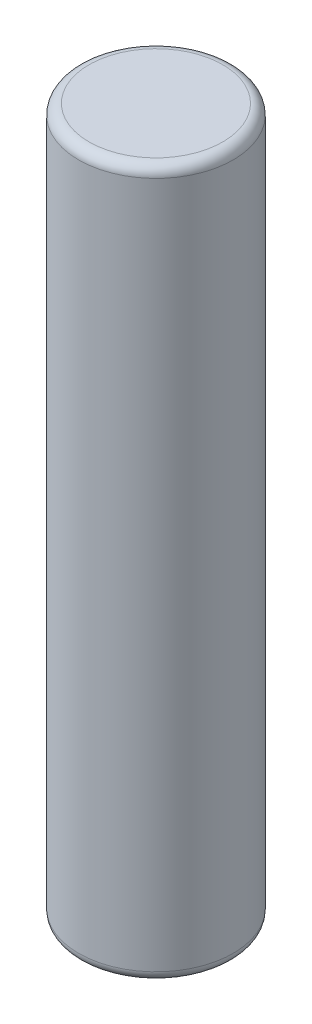
from build123d import *

# Parameters (mm, degrees)
CROQUIS1_R              = 7.425
SALIENTE_EXTRUIR1_DEPTH = 68
REDONDEO1_R             = 1


with BuildPart() as part:
    # Croquis1 → Saliente-Extruir1 (new body)
    with BuildSketch(Plane(origin=(0, 0, 0), x_dir=(1, 0, 0), z_dir=(0, 1, 0))):
        with Locations(Location((0, 0, 0), (0, 0, 270))):
            Circle(CROQUIS1_R)
    extrude(amount=SALIENTE_EXTRUIR1_DEPTH)

    # Redondeo1
    redondeo1_edges = [part.edges().sort_by_distance(p)[0] for p in [
        (0, 0, -7.425),
        (0, 68, -7.425),
    ]]
    fillet(redondeo1_edges, radius=REDONDEO1_R)


solid = part.part
